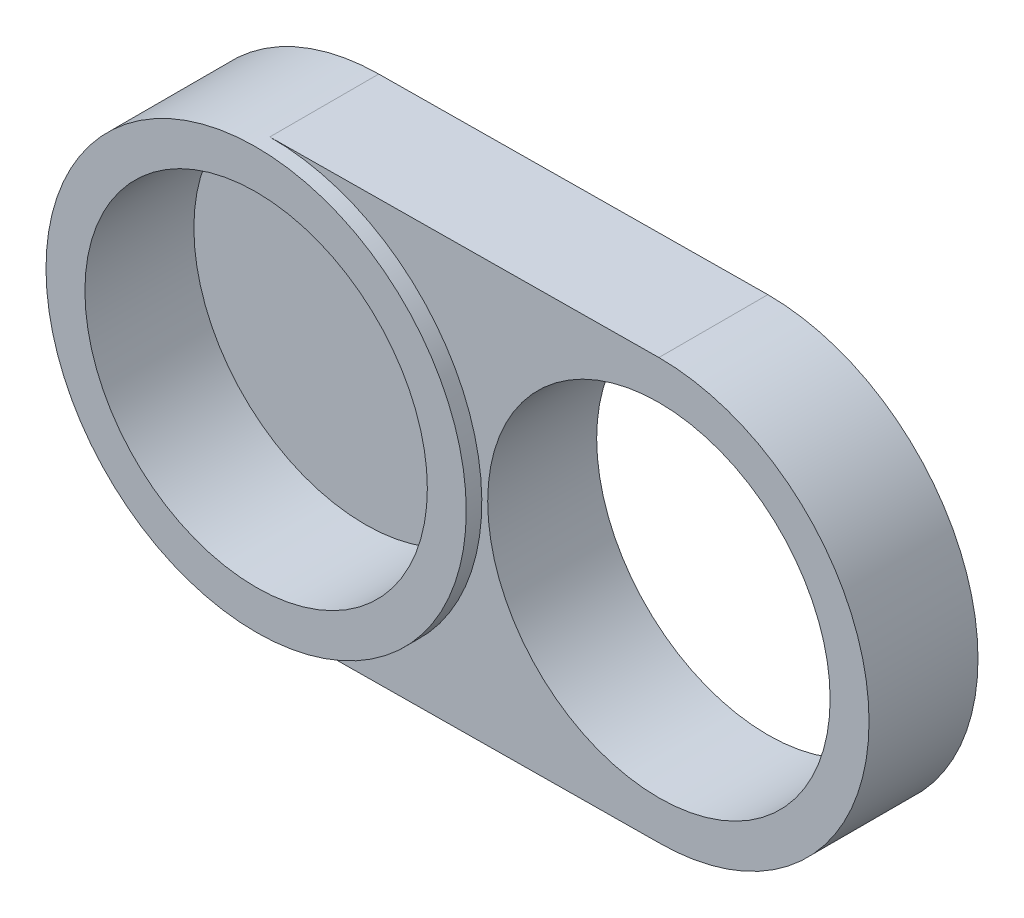
from build123d import *

# Parameters (mm, degrees)
SKETCH1_R           = 11
BOSS_EXTRUDE1_DEPTH = 7
SKETCH2_R           = 11
BOSS_EXTRUDE2_DEPTH = 1
SKETCH3_R           = 13.5
SKETCH3_R_2         = 11
BOSS_EXTRUDE3_DEPTH = 1


with BuildPart() as part:
    # Sketch1 → Boss-Extrude1 (new body)
    with BuildSketch(Plane.XY):
        with BuildLine():
            ThreePointArc((0, -13.5), (13.5, 0), (0, 13.5))
            Line((0, 13.5), (-0.244738618, 13.497781411))
            Line((-0.244738618, 13.497781411), (-25, 13.273371546))
            ThreePointArc((-25, 13.273371546), (-38.377486998, -0.287261592), (-24.877625663, -13.726073795))
            Line((-24.877625663, -13.726073795), (-24.632285191, -13.723844279))
            Line((-24.632285191, -13.723844279), (0, -13.5))
        make_face()
        with Locations((-24.877625663, -0.226073795)):
            Circle(SKETCH1_R, mode=Mode.SUBTRACT)
        Circle(SKETCH1_R, mode=Mode.SUBTRACT)
    extrude(amount=BOSS_EXTRUDE1_DEPTH)

    # Sketch2 → Boss-Extrude2 (add)
    with BuildSketch(Plane(origin=(0, 0, 0), x_dir=(-1, 0, 0), z_dir=(0, 0, -1))):
        with Locations((24.877625663, -0.226073795)):
            Circle(SKETCH2_R)
    extrude(amount=-BOSS_EXTRUDE2_DEPTH)

    # Sketch3 → Boss-Extrude3 (add)
    with BuildSketch(Plane.XY.offset(7)):
        with Locations(Location((-24.877625663, -0.226073795, 0), (0, 0, 90.519379929))):
            Circle(SKETCH3_R)
        with Locations(Location((-24.877625663, -0.226073795, 0), (0, 0, 180))):
            Circle(SKETCH3_R_2, mode=Mode.SUBTRACT)
    extrude(amount=BOSS_EXTRUDE3_DEPTH)


solid = part.part
